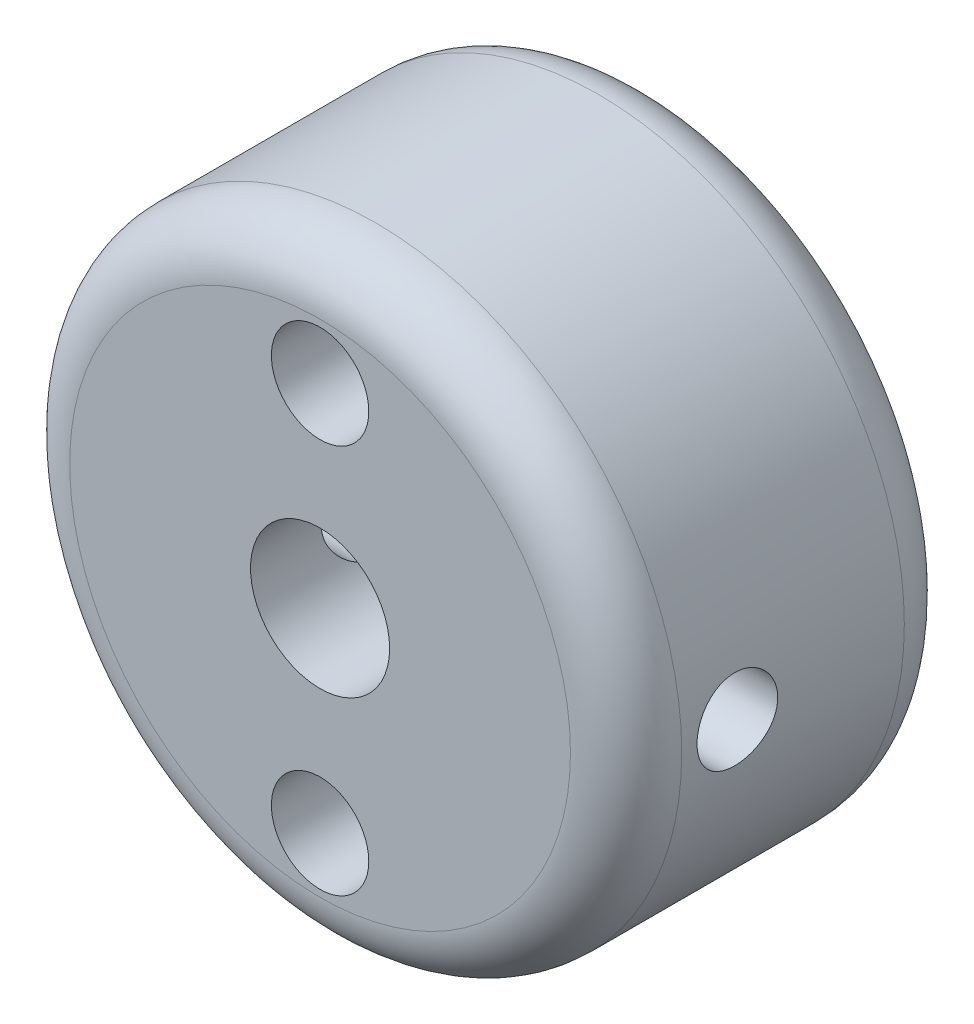
from build123d import *

# Parameters (mm, degrees)
SKETCH_1_R               = 11
EXTRUDE_1_DEPTH          = 12
SKETCH_3_R               = 1.75
CUT_EXTRUDE_1_DEPTH      = 20.646882704
SKETCH_4_R               = 2.5
CUT_EXTRUDE_2_DEPTH      = 10
CUT_EXTRUDE_3_DEPTH      = 20.646882704
CUT_EXTRUDE_3_DEPTH_BACK = 20.646882704
SKETCH_5_R               = 1.45
FILLET_1_R               = 2


with BuildPart() as part:
    # 草图1 → 凸台-拉伸1 (new body)
    with BuildSketch(Plane.XY):
        Circle(SKETCH_1_R)
    extrude(amount=EXTRUDE_1_DEPTH)

    # 草图3 → 切除-拉伸1 (cut, through all)
    with BuildSketch(Plane.XY.offset(12)):
        with Locations((0, 7)):
            Circle(SKETCH_3_R)
        with Locations((0, -7)):
            Circle(SKETCH_3_R)
    extrude(amount=-CUT_EXTRUDE_1_DEPTH, mode=Mode.SUBTRACT)

    # 草图4 → 切除-拉伸2 (cut)
    with BuildSketch(Plane.XY.offset(12)):
        Circle(SKETCH_4_R)
    extrude(amount=-CUT_EXTRUDE_2_DEPTH, mode=Mode.SUBTRACT)

    # 草图5 → 切除-拉伸3 (cut, two sides: drawn at the far end of the back side and taken through both)
    with BuildSketch(Plane(origin=(0, 0, 0), x_dir=(0, 0, -1), z_dir=(1, 0, 0)).offset(-CUT_EXTRUDE_3_DEPTH_BACK)):
        with Locations((-8, 0)):
            Circle(SKETCH_5_R)
    extrude(amount=CUT_EXTRUDE_3_DEPTH + CUT_EXTRUDE_3_DEPTH_BACK, mode=Mode.SUBTRACT)

    # 圆角1
    fillet_1_edges = [part.edges().sort_by_distance(p)[0] for p in [
        (-11, 0, 0),
        (-11, 0, 12),
    ]]
    fillet(fillet_1_edges, radius=FILLET_1_R)


solid = part.part
